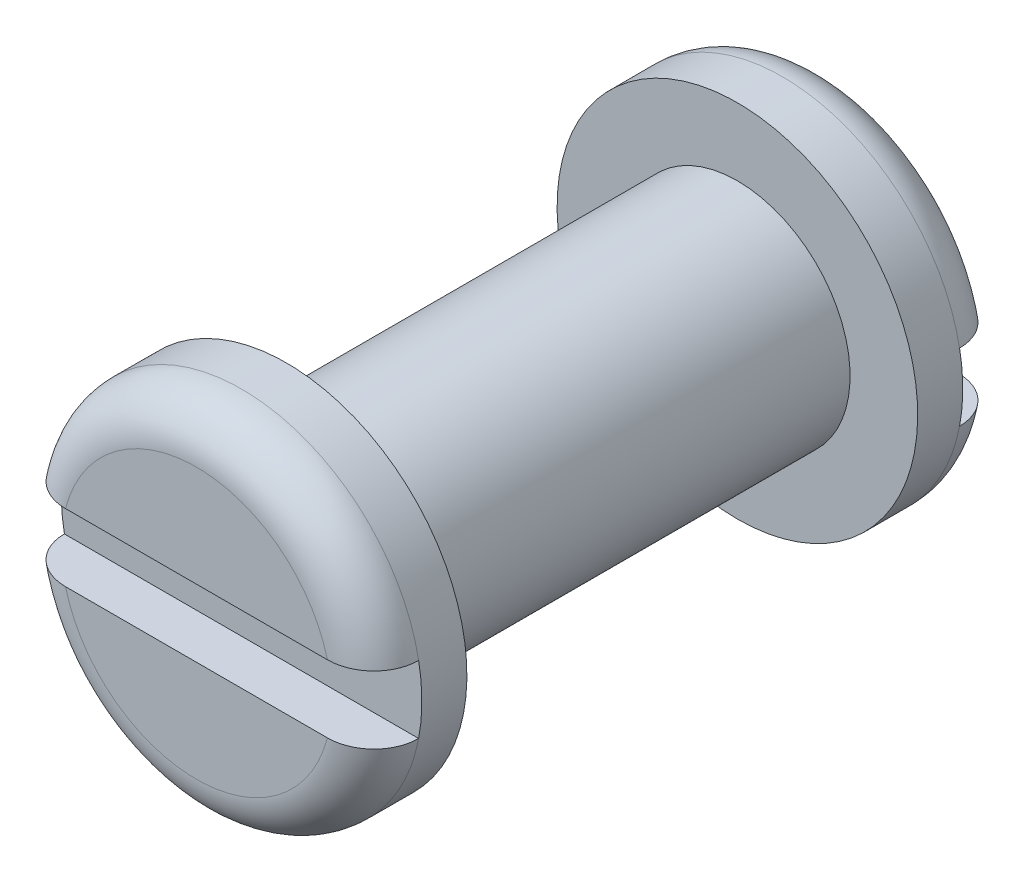
from build123d import *

# Parameters (mm, degrees)
CUT_EXTRUDE1_DEPTH      = 10
CUT_EXTRUDE1_DEPTH_BACK = 10
SKETCH3_W               = 1.5
SKETCH3_H               = 1


with BuildPart() as part:
    # Sketch1 → Revolve1 (revolve)
    with BuildSketch(Plane.YZ, mode=Mode.PRIVATE) as revolve1_sk:
        with BuildLine():
            Line((0, 7), (3, 7))
            ThreePointArc((3, 7), (3.707106781, 6.707106781), (4, 6))
            Line((4, 6), (4, 5))
            Line((4, 5), (2.5, 5))
            Line((2.5, 5), (2.5, -5))
            Line((2.5, -5), (4, -5))
            Line((4, -5), (4, -6))
            ThreePointArc((4, -6), (3.707106781, -6.707106781), (3, -7))
            Line((3, -7), (0, -7))
            Line((0, -7), (0, 7))
        make_face()
    revolve(revolve1_sk.sketch.rotate(Axis((0, 0, 9.31839629), (0, 0, -1)), 180), axis=Axis((0, 0, 9.31839629), (0, 0, -1)))

    # Sketch3 → Cut-Extrude1 (cut, two sides: drawn at the far end of the back side and taken through both)
    with BuildSketch(Plane.YZ.offset(-CUT_EXTRUDE1_DEPTH_BACK)):
        with Locations((0, 6.5)):
            Rectangle(SKETCH3_W, SKETCH3_H)
        with Locations((0, -6.5)):
            Rectangle(SKETCH3_W, SKETCH3_H)
    extrude(amount=CUT_EXTRUDE1_DEPTH + CUT_EXTRUDE1_DEPTH_BACK, mode=Mode.SUBTRACT)


solid = part.part
